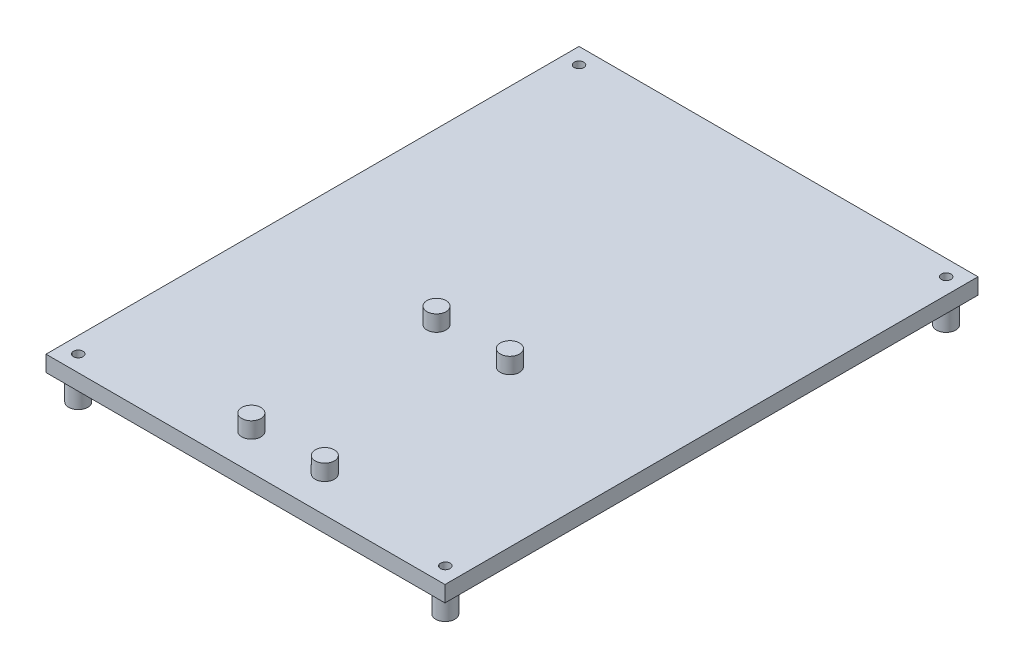
from build123d import *

# Parameters (mm, degrees)
ESQUISSE1_W                  = 125
ESQUISSE1_H                  = 167
BOSS_EXTRU_1_DEPTH           = 5
ENL_V_MAT_EXTRU_1_DEPTH      = 105.419825704
ENL_V_MAT_EXTRU_1_DEPTH_BACK = 105.419825704
ESQUISSE2_R                  = 1.5
ESQUISSE3_R                  = 2.992151318
BOSS_EXTRU_2_DEPTH           = 8
ESQUISSE5_R                  = 1.5
ENL_V_MAT_EXTRU_2_DEPTH      = 106.107088248
ESQUISSE6_R                  = 3
BOSS_EXTRU_3_DEPTH           = 5


with BuildPart() as part:
    # Esquisse1 → Boss.-Extru.1 (new body)
    with BuildSketch(Plane(origin=(0, 0, 0), x_dir=(1, 0, 0), z_dir=(0, 1, 0))):
        Rectangle(ESQUISSE1_W, ESQUISSE1_H)
    extrude(amount=BOSS_EXTRU_1_DEPTH)

    # Esquisse2 → Enlèv. mat.-Extru.1 (cut, two sides: drawn at the far end of the back side and taken through both)
    with BuildSketch(Plane.XZ.offset(-ENL_V_MAT_EXTRU_1_DEPTH_BACK)):
        with Locations(Location((-57.5, 78.4, 0), (0, 0, 90))):
            Circle(ESQUISSE2_R)
        with Locations(Location((57.5, 78.4, 0), (0, 0, 90))):
            Circle(ESQUISSE2_R)
        with Locations(Location((57.5, -78.5, 0), (0, 0, 90))):
            Circle(ESQUISSE2_R)
        with Locations(Location((-57.5, -78.5, 0), (0, 0, 90))):
            Circle(ESQUISSE2_R)
    extrude(amount=ENL_V_MAT_EXTRU_1_DEPTH + ENL_V_MAT_EXTRU_1_DEPTH_BACK, mode=Mode.SUBTRACT)

    # Esquisse3 → Boss.-Extru.2 (add)
    with BuildSketch(Plane.XZ):
        with Locations(Location((-57.5, 78.4, 0), (0, 0, 270))):
            Circle(ESQUISSE3_R)
        with Locations(Location((57.5, 78.4, 0), (0, 0, 270))):
            Circle(ESQUISSE3_R)
        with Locations(Location((57.5, -78.5, 0), (0, 0, 270))):
            Circle(ESQUISSE3_R)
        with Locations(Location((-57.5, -78.5, 0), (0, 0, 270))):
            Circle(ESQUISSE3_R)
    extrude(amount=BOSS_EXTRU_2_DEPTH)

    # Esquisse5 → Enlèv. mat.-Extru.2 (cut, through all)
    with BuildSketch(Plane(origin=(0, 5, 0), x_dir=(1, 0, 0), z_dir=(0, 1, 0))):
        with Locations(Location((-57.5, 78.5, 0), (0, 0, 270))):
            Circle(ESQUISSE5_R)
        with Locations(Location((57.5, 78.5, 0), (0, 0, 270))):
            Circle(ESQUISSE5_R)
        with Locations(Location((57.5, -78.4, 0), (0, 0, 270))):
            Circle(ESQUISSE5_R)
        with Locations(Location((-57.5, -78.4, 0), (0, 0, 270))):
            Circle(ESQUISSE5_R)
    extrude(amount=-ENL_V_MAT_EXTRU_2_DEPTH, mode=Mode.SUBTRACT)

    # Esquisse6 → Boss.-Extru.3 (add)
    with BuildSketch(Plane(origin=(0, 5, 0), x_dir=(1, 0, 0), z_dir=(0, 1, 0))):
        with Locations(Location((-9.368446166, -72.288956225, 0), (0, 0, 90))):
            Circle(ESQUISSE6_R)
        with Locations(Location((-9.368446166, -14.288956225, 0), (0, 0, 90))):
            Circle(ESQUISSE6_R)
        with Locations(Location((13.631553834, -14.288956225, 0), (0, 0, 90))):
            Circle(ESQUISSE6_R)
        with Locations(Location((13.631553834, -72.288956225, 0), (0, 0, 90))):
            Circle(ESQUISSE6_R)
    extrude(amount=BOSS_EXTRU_3_DEPTH)


solid = part.part
